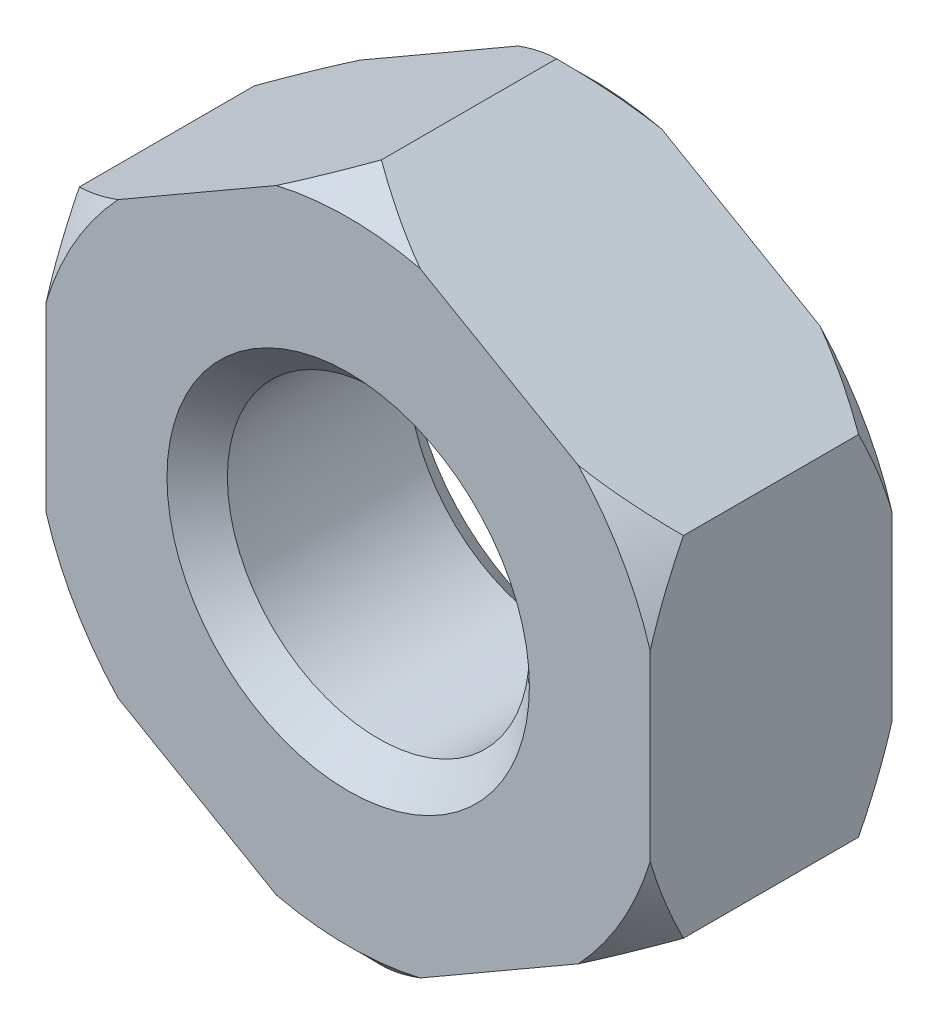
from build123d import *

# Parameters (mm, degrees)
EXTRUDE_1_DEPTH     = 2
SKETCH_2_R          = 1.25
CUT_EXTRUDE_1_DEPTH = 5.310839052
CHAMFER_1_SIZE      = 0.25


with BuildPart() as part:
    # Эскиз1 → Вытянуть1 (new body)
    with BuildSketch(Plane.XY):
        Polygon((0, 2.886751346), (-2.5, 1.443375673), (-2.5, -1.443375673), (0, -2.886751346), (2.5, -1.443375673), (2.5, 1.443375673), align=None)
    extrude(amount=EXTRUDE_1_DEPTH)

    # Эскиз15 → Вырез-Повернуть1 (revolve, cut)
    with BuildSketch(Plane(origin=(0, 0, 0), x_dir=(0, 0, -1), z_dir=(1, 0, 0))):
        Polygon((-2, 2.886751346), (-2, 2.611751346), (-1.725, 2.886751346), align=None)
        Polygon((-0.275, 2.886751346), (0, 2.886751346), (0, 2.611751346), align=None)
    revolve(axis=Axis((0, 0, 2.633835381), (0, 0, -1)), mode=Mode.SUBTRACT)

    # Эскиз2 → Вырез-Вытянуть1 (cut, through all)
    with BuildSketch(Plane(origin=(0, 0, 0), x_dir=(-1, 0, 0), z_dir=(0, 0, -1))):
        Circle(SKETCH_2_R)
    extrude(amount=-CUT_EXTRUDE_1_DEPTH, mode=Mode.SUBTRACT)

    # Фаска1
    chamfer_1_edges = [part.edges().sort_by_distance(p)[0] for p in [
        (1.25, 0, 2),
        (1.25, 0, 0),
    ]]
    chamfer(chamfer_1_edges, length=CHAMFER_1_SIZE)


solid = part.part
